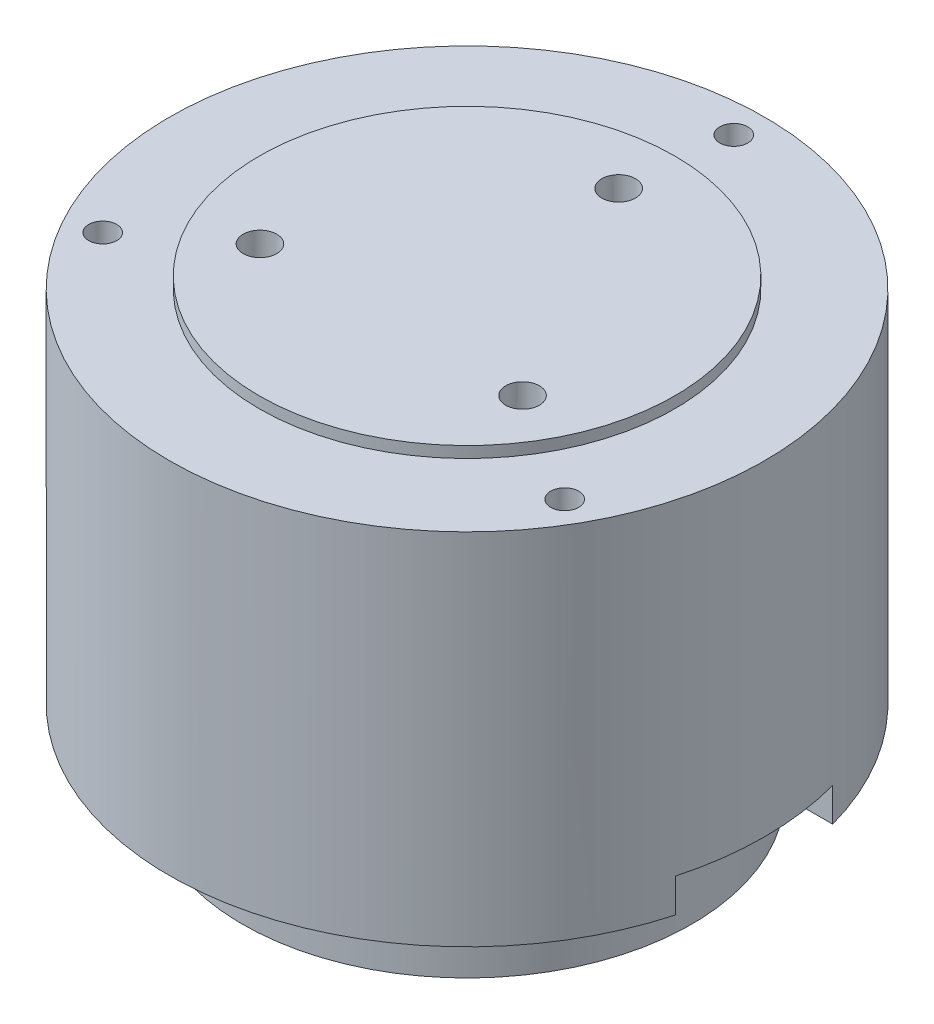
from build123d import *

# Parameters (mm, degrees)
SKETCH1_R           = 26.5
BOSS_EXTRUDE1_DEPTH = 32
SKETCH2_R           = 20
BOSS_EXTRUDE2_DEPTH = 7
SKETCH3_R           = 18.5
BOSS_EXTRUDE3_DEPTH = 1
SKETCH4_R           = 1.25
CUT_EXTRUDE1_DEPTH  = 3
SKETCH5_R           = 1.5
CUT_EXTRUDE2_DEPTH  = 4
CUT_EXTRUDE3_START  = -5
SKETCH6_R           = 1.25
CUT_EXTRUDE3_DEPTH  = 5
SKETCH7_W           = 60.119067385
SKETCH7_H           = 14
CUT_EXTRUDE4_DEPTH  = 3


with BuildPart() as part:
    # Sketch1 → Boss-Extrude1 (new body)
    with BuildSketch(Plane(origin=(0, 0, 0), x_dir=(1, 0, 0), z_dir=(0, 1, 0))):
        with Locations(Location((0, 0, 0), (0, 0, 270))):
            Circle(SKETCH1_R)
    extrude(amount=BOSS_EXTRUDE1_DEPTH)

    # Sketch2 → Boss-Extrude2 (add)
    with BuildSketch(Plane.XZ):
        with Locations(Location((0, 0, 0), (0, 0, 270))):
            Circle(SKETCH2_R)
    extrude(amount=BOSS_EXTRUDE2_DEPTH)

    # Sketch3 → Boss-Extrude3 (add)
    with BuildSketch(Plane(origin=(0, 32, 0), x_dir=(1, 0, 0), z_dir=(0, 1, 0))):
        with Locations(Location((0, 0, 0), (0, 0, 270))):
            Circle(SKETCH3_R)
    extrude(amount=BOSS_EXTRUDE3_DEPTH)

    # Sketch4 → Cut-Extrude1 (cut)
    with BuildSketch(Plane.XZ):
        with Locations(Location((0, 23.75, 0), (0, 0, 270))):
            Circle(SKETCH4_R)
        with Locations(Location((20.56810334, 11.875, 0), (0, 0, 270))):
            Circle(SKETCH4_R)
        with Locations(Location((20.56810334, -11.875, 0), (0, 0, 270))):
            Circle(SKETCH4_R)
        with Locations(Location((0, -23.75, 0), (0, 0, 270))):
            Circle(SKETCH4_R)
        with Locations(Location((-20.56810334, -11.875, 0), (0, 0, 270))):
            Circle(SKETCH4_R)
        with Locations(Location((-20.56810334, 11.875, 0), (0, 0, 270))):
            Circle(SKETCH4_R)
    extrude(amount=-CUT_EXTRUDE1_DEPTH, mode=Mode.SUBTRACT)

    # Sketch5 → Cut-Extrude2 (cut)
    with BuildSketch(Plane(origin=(0, 33, 0), x_dir=(1, 0, 0), z_dir=(0, 1, 0))):
        with Locations(Location((0, 13.5, 0), (0, 0, 270))):
            Circle(SKETCH5_R)
        with Locations(Location((11.691342951, -6.75, 0), (0, 0, 270))):
            Circle(SKETCH5_R)
        with Locations(Location((-11.691342951, -6.75, 0), (0, 0, 270))):
            Circle(SKETCH5_R)
    extrude(amount=-CUT_EXTRUDE2_DEPTH, mode=Mode.SUBTRACT)

    # Sketch6 → Cut-Extrude3 (cut)
    with BuildSketch(Plane(origin=(0, 32, 0), x_dir=(1, 0, 0), z_dir=(0, 1, 0)).offset(CUT_EXTRUDE3_START)):
        with Locations(Location((0, 23.75, 0), (0, 0, 90))):
            Circle(SKETCH6_R)
        with Locations(Location((20.56810334, -11.875, 0), (0, 0, 90))):
            Circle(SKETCH6_R)
        with Locations(Location((-20.56810334, -11.875, 0), (0, 0, 90))):
            Circle(SKETCH6_R)
    extrude(amount=CUT_EXTRUDE3_DEPTH, mode=Mode.SUBTRACT)

    # Sketch7 → Cut-Extrude4 (cut)
    with BuildSketch(Plane.XZ):
        with Locations((1.148519733, 0)):
            Rectangle(SKETCH7_W, SKETCH7_H)
    extrude(amount=-CUT_EXTRUDE4_DEPTH, mode=Mode.SUBTRACT)


solid = part.part
